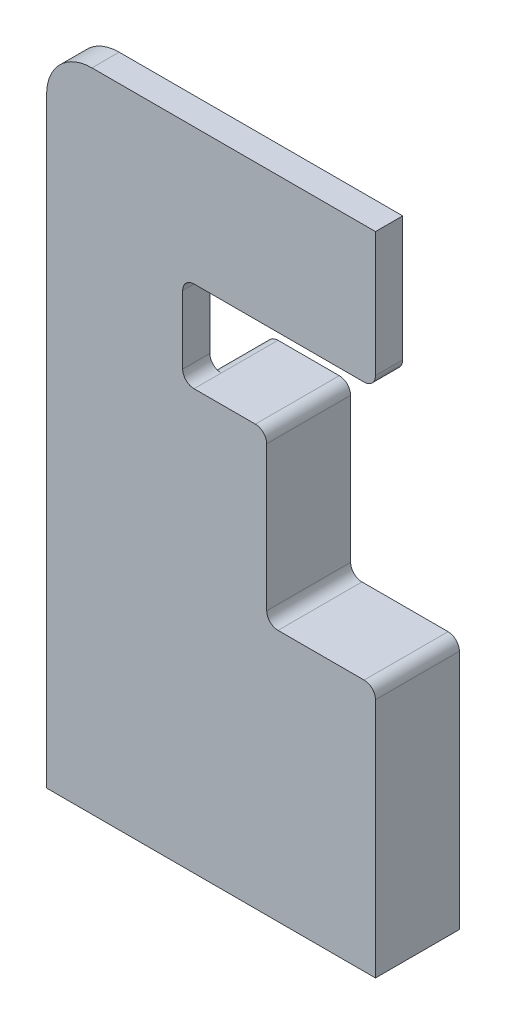
from build123d import *

# Parameters (mm, degrees)
SKETCH1_W           = 17
SKETCH1_H           = 45
BOSS_EXTRUDE1_DEPTH = 12
BOSS_EXTRUDE2_DEPTH = 7
FILLET1_R           = 4
CUT_EXTRUDE1_DEPTH  = 42.886752082
CUT_EXTRUDE2_START  = -4.6
CUT_EXTRUDE2_DEPTH  = 4.6
SKETCH5_W           = 8
SKETCH5_H           = 8
CUT_EXTRUDE3_DEPTH  = 41.807597332
FILLET2_R           = 1
FILLET3_R           = 1


with BuildPart() as part:
    # Sketch1 → Boss-Extrude1 (new body)
    with BuildSketch(Plane.XY):
        Rectangle(SKETCH1_W, SKETCH1_H)
    extrude(amount=BOSS_EXTRUDE1_DEPTH)

    # Sketch2 → Boss-Extrude2 (add)
    with BuildSketch(Plane.XY.offset(12)):
        Polygon((-8.5, -22.5), (-8.5, 22.5), (8.5, 22.5), (8.5, 34.5), (-20.5, 34.5), (-20.5, -22.5), align=None)
    extrude(amount=-BOSS_EXTRUDE2_DEPTH)

    # Fillet1
    fillet1_edges = [part.edges().sort_by_distance(p)[0] for p in [
        (-20.5, 34.5, 8.5),
    ]]
    fillet(fillet1_edges, radius=FILLET1_R)

    # Sketch3 → Cut-Extrude1 (cut, through all)
    with BuildSketch(Plane(origin=(0, 0, 0), x_dir=(-1, 0, 0), z_dir=(0, 0, -1))):
        Polygon((-2.5, -0.25), (1.091673087, -0.25), (1.091673087, 22.5), (-8.5, 22.5), (-8.5, -0.25), (-3.5, -0.25), align=None)
    extrude(amount=-CUT_EXTRUDE1_DEPTH, mode=Mode.SUBTRACT)

    # Sketch4 → Cut-Extrude2 (cut)
    with BuildSketch(Plane.XY.offset(12).offset(CUT_EXTRUDE2_START)):
        with BuildLine():
            Line((-1.091673087, -0.25), (-1.091673087, 22.5))
            Line((-1.091673087, 22.5), (8.5, 22.5))
            Line((8.5, 22.5), (8.5, 34.5))
            Line((8.5, 34.5), (-16.5, 34.5))
            ThreePointArc((-16.5, 34.5), (-19.328427125, 33.328427125), (-20.5, 30.5))
            Line((-20.5, 30.5), (-20.5, -22.5))
            Line((-20.5, -22.5), (8.5, -22.5))
            Line((8.5, -22.5), (8.5, -0.25))
            Line((8.5, -0.25), (-1.091673087, -0.25))
        make_face()
    extrude(amount=CUT_EXTRUDE2_DEPTH, mode=Mode.SUBTRACT)

    # Sketch5 → Cut-Extrude3 (cut, through all)
    with BuildSketch(Plane(origin=(0, 0, 0), x_dir=(-1, 0, 0), z_dir=(0, 0, -1))):
        with Locations((4.5, 18.5)):
            Rectangle(SKETCH5_W, SKETCH5_H)
    extrude(amount=-CUT_EXTRUDE3_DEPTH, mode=Mode.SUBTRACT)

    # Fillet2
    fillet2_edges = [part.edges().sort_by_distance(p)[0] for p in [
        (-8.5, 22.5, 6.2),
        (-8.5, 14.5, 6.2),
        (-1.091673087, 14.5, 3.7),
        (-1.091673087, -0.25, 3.7),
        (8.5, -0.25, 3.7),
        (8.5, 22.5, 6.2),
    ]]
    fillet(fillet2_edges, radius=FILLET2_R)

    # Fillet3
    fillet3_edges = [part.edges().sort_by_distance(p)[0] for p in [
        (-8.5, -22.5, 2.5),
        (-8.5, 14.5, 2.5),
    ]]
    fillet(fillet3_edges, radius=FILLET3_R)


solid = part.part
